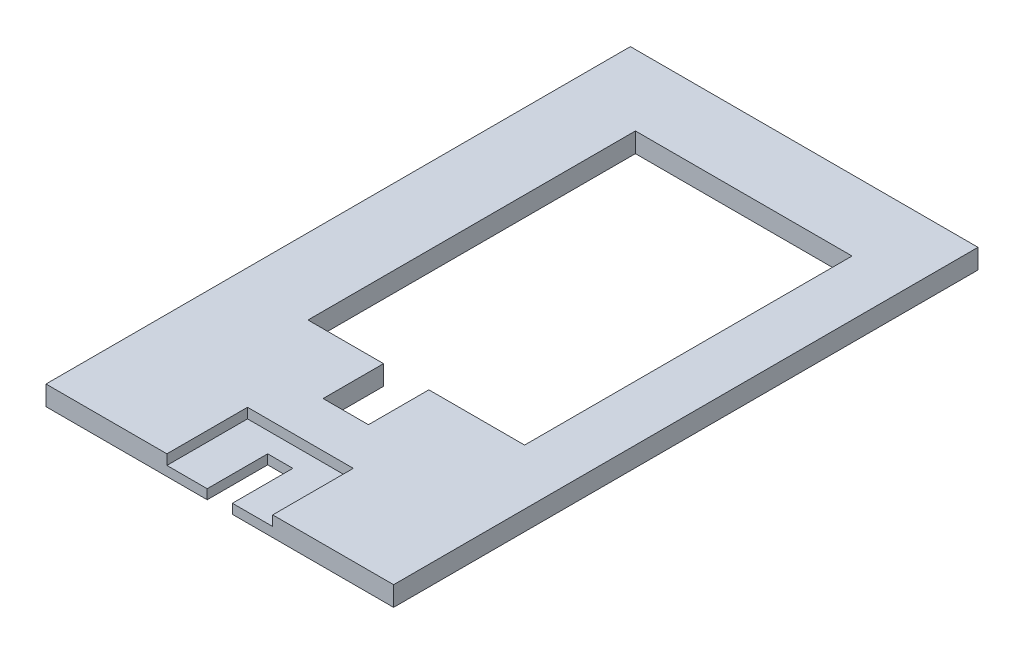
from build123d import *

# Parameters (mm, degrees)
SKETCH1_W                      = 345
SKETCH1_H                      = 580
BOSS_EXTRUDE1_DEPTH            = 19.53
CUT_EXTRUDE1_REACH             = 450.263
SKETCH2_W                      = 215
SKETCH2_H                      = 325
CUT_EXTRUDE1_DIRECTION_2_DEPTH = 449.2627239
SKETCH3_W                      = 45
SKETCH3_H                      = 60
CUT_EXTRUDE2_DEPTH             = 19.53
SKETCH4_W                      = 105
SKETCH4_H                      = 80
CUT_EXTRUDE3_DEPTH             = 10
SKETCH5_W                      = 25
SKETCH5_H                      = 60
CUT_EXTRUDE4_DEPTH             = 10


with BuildPart() as part:
    # Sketch1 → Boss-Extrude1 (new body)
    with BuildSketch(Plane(origin=(0, 0, 0), x_dir=(1, 0, 0), z_dir=(0, 1, 0))):
        with Locations((15.072815534, 116.662621359)):
            Rectangle(SKETCH1_W, SKETCH1_H)
    extrude(amount=BOSS_EXTRUDE1_DEPTH)

    # Sketch2 → Cut-Extrude1 (cut, up to next)
    with BuildSketch(Plane(origin=(0, 19.53, 0), x_dir=(1, 0, 0), z_dir=(0, 1, 0)), mode=Mode.PRIVATE) as cut_extrude1_sk1:
        with Locations((25.072815534, 174.162621359)):
            Rectangle(SKETCH2_W, SKETCH2_H)
    cut_extrude1_tool1 = extrude(cut_extrude1_sk1.sketch, amount=-CUT_EXTRUDE1_REACH, mode=Mode.PRIVATE) & part.part
    add(cut_extrude1_tool1.solids().sort_by_distance((25.072816, 19.53, -174.162621))[0], mode=Mode.SUBTRACT)

    # Sketch2 → Cut-Extrude1 direction 2 (cut)
    with BuildSketch(Plane(origin=(0, 19.53, 0), x_dir=(1, 0, 0), z_dir=(0, 1, 0))):
        with Locations((25.072815534, 174.162621359)):
            Rectangle(SKETCH2_W, SKETCH2_H)
    extrude(amount=CUT_EXTRUDE1_DIRECTION_2_DEPTH, mode=Mode.SUBTRACT)

    # Sketch3 → Cut-Extrude2 (cut)
    with BuildSketch(Plane(origin=(0, 19.53, 0), x_dir=(1, 0, 0), z_dir=(0, 1, 0))):
        with Locations((15.072815534, -18.337378641)):
            Rectangle(SKETCH3_W, SKETCH3_H)
    extrude(amount=-CUT_EXTRUDE2_DEPTH, mode=Mode.SUBTRACT)

    # Sketch4 → Cut-Extrude3 (cut)
    with BuildSketch(Plane(origin=(0, 19.53, 0), x_dir=(1, 0, 0), z_dir=(0, 1, 0))):
        with Locations((15.072815534, -133.337378641)):
            Rectangle(SKETCH4_W, SKETCH4_H)
    extrude(amount=-CUT_EXTRUDE3_DEPTH, mode=Mode.SUBTRACT)

    # Sketch5 → Cut-Extrude4 (cut)
    with BuildSketch(Plane(origin=(0, 9.53, 0), x_dir=(1, 0, 0), z_dir=(0, 1, 0))):
        with Locations((15.072815534, -143.337378641)):
            Rectangle(SKETCH5_W, SKETCH5_H)
    extrude(amount=-CUT_EXTRUDE4_DEPTH, mode=Mode.SUBTRACT)


solid = part.part
